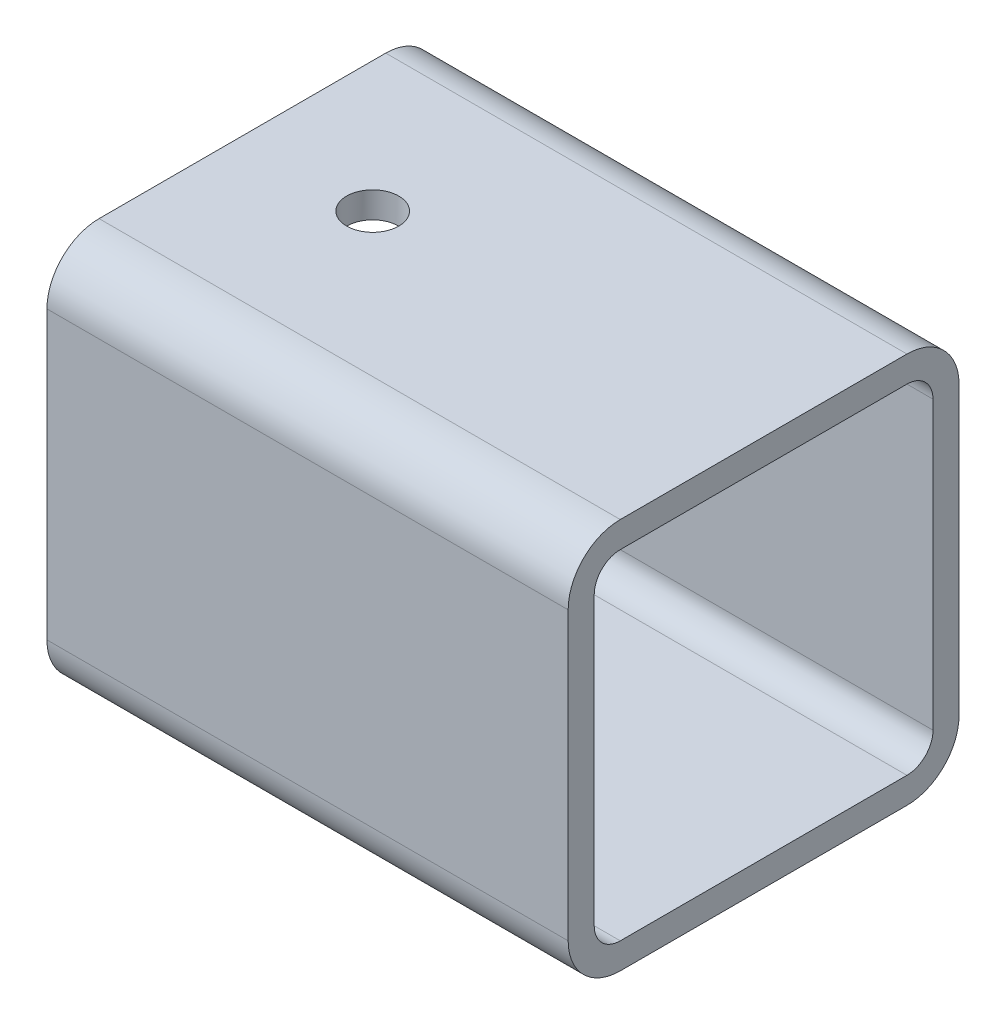
from build123d import *

# Parameters (mm, degrees)
EXTRUDE_1_DEPTH          = 20
CUT_EXTRUDE_1_DEPTH      = 30.154759474
CUT_EXTRUDE_1_DEPTH_BACK = 30.154759474
SKETCH_2_R               = 2


with BuildPart() as part:
    # 草图1 → 凸台-拉伸1 (new, symmetric)
    with BuildSketch(Plane(origin=(0, 0, 0), x_dir=(0, 0, -1), z_dir=(1, 0, 0))):
        with BuildLine():
            Line((-11, -15), (11, -15))
            ThreePointArc((11, -15), (13.828427125, -13.828427125), (15, -11))
            Line((15, -11), (15, 11))
            ThreePointArc((15, 11), (13.828427125, 13.828427125), (11, 15))
            Line((11, 15), (-11, 15))
            ThreePointArc((-11, 15), (-13.828427125, 13.828427125), (-15, 11))
            Line((-15, 11), (-15, -11))
            ThreePointArc((-15, -11), (-13.828427125, -13.828427125), (-11, -15))
        make_face()
        with BuildLine():
            Line((-11, -13), (11, -13))
            ThreePointArc((11, -13), (12.414213562, -12.414213562), (13, -11))
            Line((13, -11), (13, 11))
            ThreePointArc((13, 11), (12.414213562, 12.414213562), (11, 13))
            Line((11, 13), (-11, 13))
            ThreePointArc((-11, 13), (-12.414213562, 12.414213562), (-13, 11))
            Line((-13, 11), (-13, -11))
            ThreePointArc((-13, -11), (-12.414213562, -12.414213562), (-11, -13))
        make_face(mode=Mode.SUBTRACT)
    extrude(amount=EXTRUDE_1_DEPTH, both=True)

    # 草图2 → 切除-拉伸1 (cut, two sides: drawn at the far end of the back side and taken through both)
    with BuildSketch(Plane(origin=(0, 0, 0), x_dir=(1, 0, 0), z_dir=(0, 1, 0)).offset(-CUT_EXTRUDE_1_DEPTH_BACK)):
        with Locations(Location((-10, 0, 0), (0, 0, 270))):
            Circle(SKETCH_2_R)
    extrude(amount=CUT_EXTRUDE_1_DEPTH + CUT_EXTRUDE_1_DEPTH_BACK, mode=Mode.SUBTRACT)


solid = part.part
